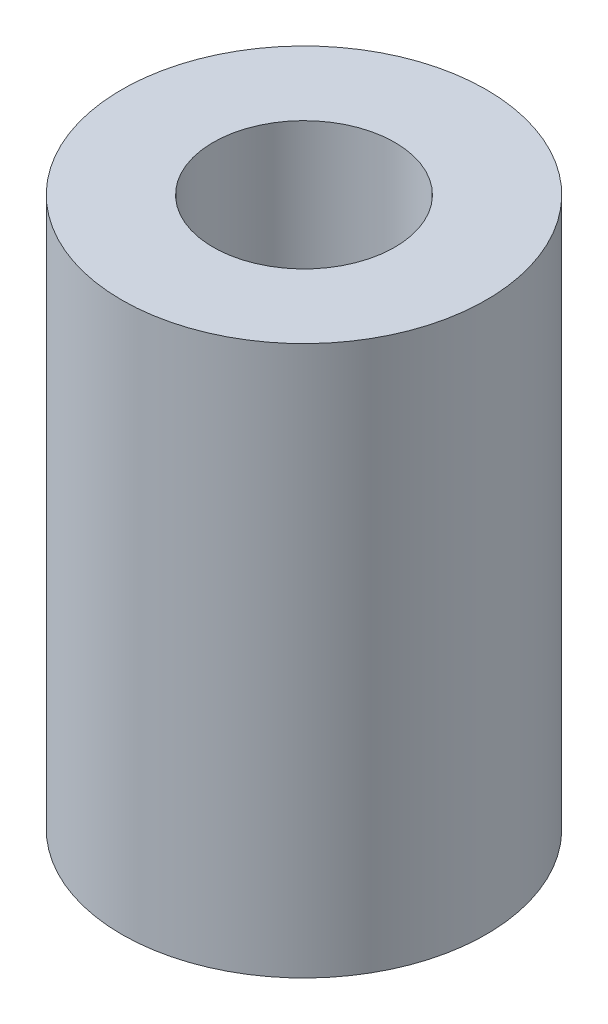
from build123d import *

# Parameters (mm, degrees)
SKETCH1_R        = 6.32
SKETCH1_R_2      = 3.15
EXTRUSION1_DEPTH = 19.05


with BuildPart() as part:
    # Sketch1 → Extrusion1 (new body)
    with BuildSketch(Plane(origin=(0, 0, 0), x_dir=(-1, 0, 0), z_dir=(0, 1, 0))):
        with Locations(Location((0, 0, 0), (0, 0, 270))):
            Circle(SKETCH1_R)
        with Locations(Location((0, 0, 0), (0, 0, 270))):
            Circle(SKETCH1_R_2, mode=Mode.SUBTRACT)
    extrude(amount=EXTRUSION1_DEPTH)


solid = part.part
